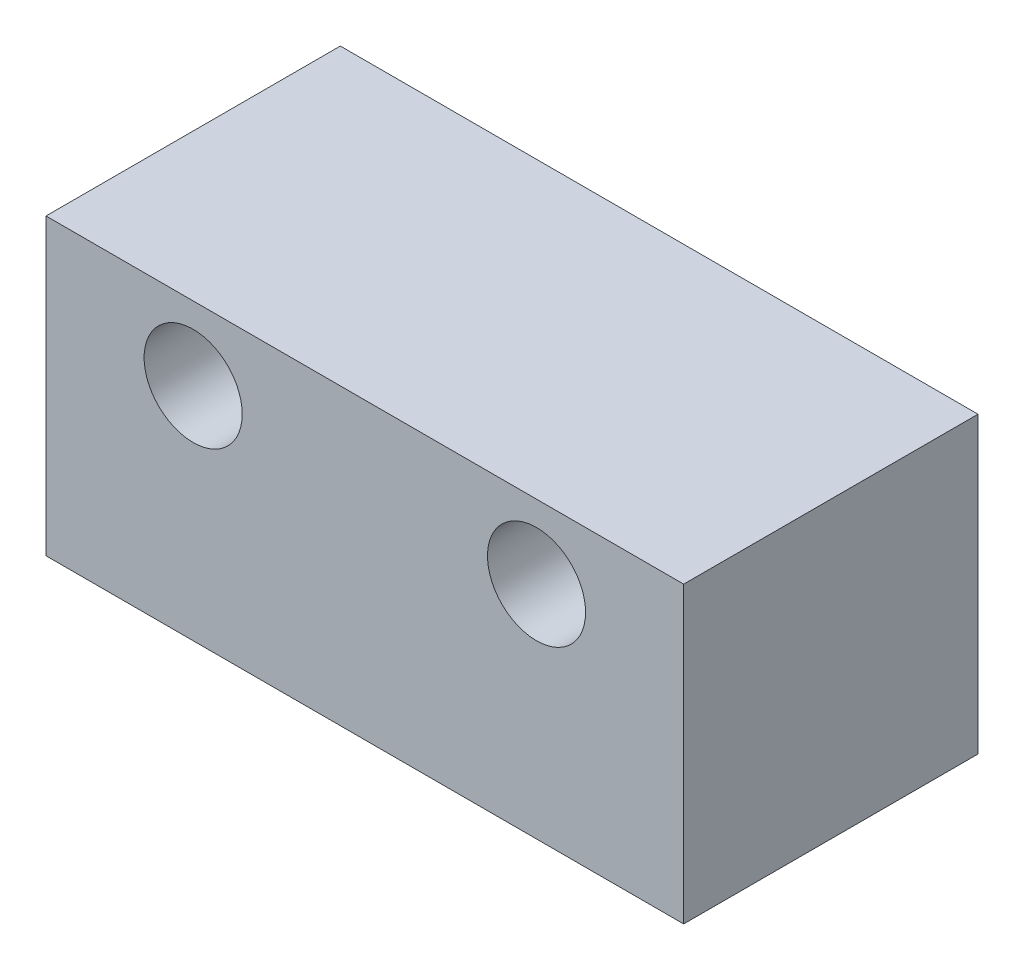
from build123d import *

# Parameters (mm, degrees)
SKETCH_1_W          = 13
SKETCH_1_H          = 6
EXTRUDE_1_DEPTH     = 6
SKETCH_2_R          = 1
CUT_EXTRUDE_1_DEPTH = 6


with BuildPart() as part:
    # 草图1 → 凸台-拉伸1 (new body)
    with BuildSketch(Plane.XY):
        with Locations((6.5, 3)):
            Rectangle(SKETCH_1_W, SKETCH_1_H)
    extrude(amount=EXTRUDE_1_DEPTH)

    # 草图2 → 切除-拉伸1 (cut)
    with BuildSketch(Plane.XY.offset(6)):
        with Locations((3, 4.5)):
            Circle(SKETCH_2_R)
        with Locations((10, 4.5)):
            Circle(SKETCH_2_R)
    extrude(amount=-CUT_EXTRUDE_1_DEPTH, mode=Mode.SUBTRACT)


solid = part.part
